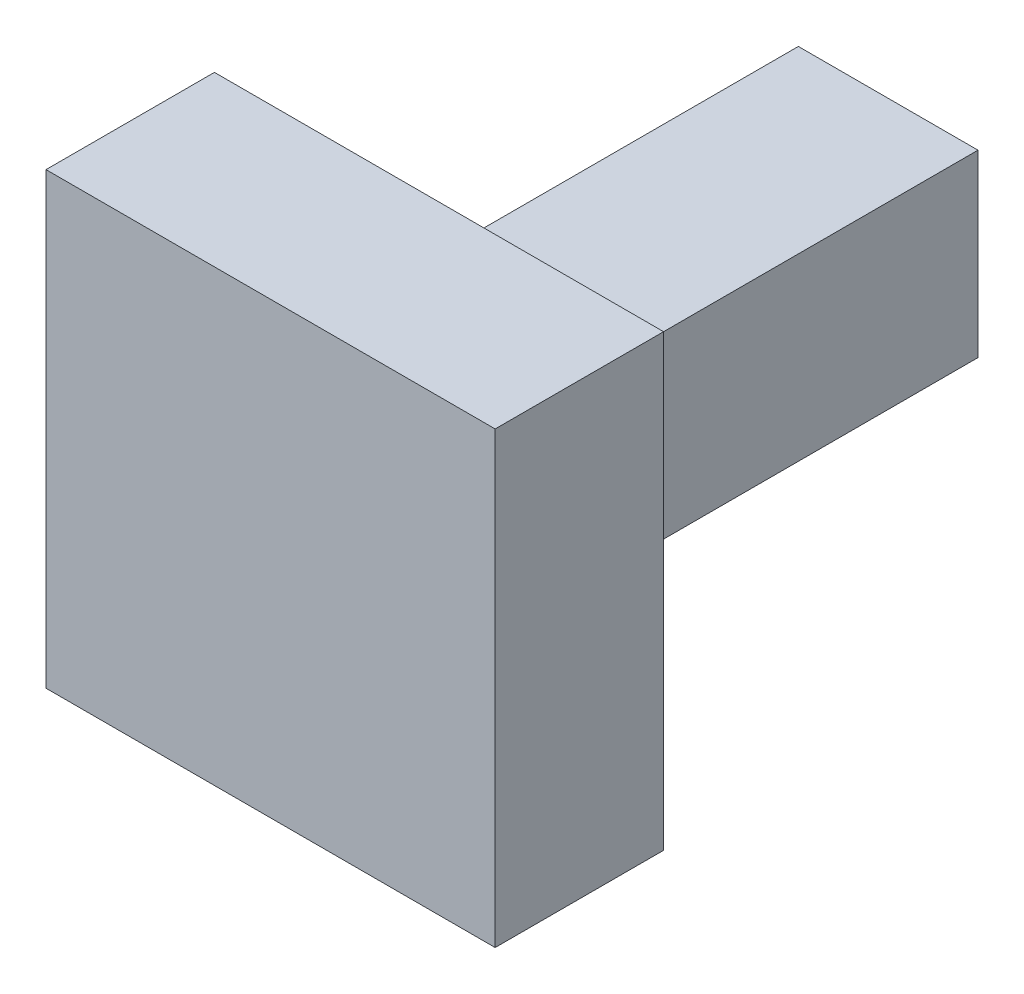
from build123d import *

# Parameters (mm, degrees)
SKETCH_1_W      = 40
SKETCH_1_H      = 40
SKETCH_1_W_2    = 16
SKETCH_1_H_2    = 16
EXTRUDE_2_DEPTH = 15
SKETCH_2_W      = 16
SKETCH_2_H      = 16
EXTRUDE_3_DEPTH = 55


with BuildPart() as part:
    # 草图1 → 凸台-拉伸2 (new body)
    with BuildSketch(Plane.XY):
        Rectangle(SKETCH_1_W, SKETCH_1_H)
        Rectangle(SKETCH_1_W_2, SKETCH_1_H_2, mode=Mode.SUBTRACT)
    extrude(amount=EXTRUDE_2_DEPTH)

    # 草图2 → 凸台-拉伸3 (add)
    with BuildSketch(Plane.XY.offset(15)):
        Rectangle(SKETCH_2_W, SKETCH_2_H)
    extrude(amount=-EXTRUDE_3_DEPTH)


solid = part.part
